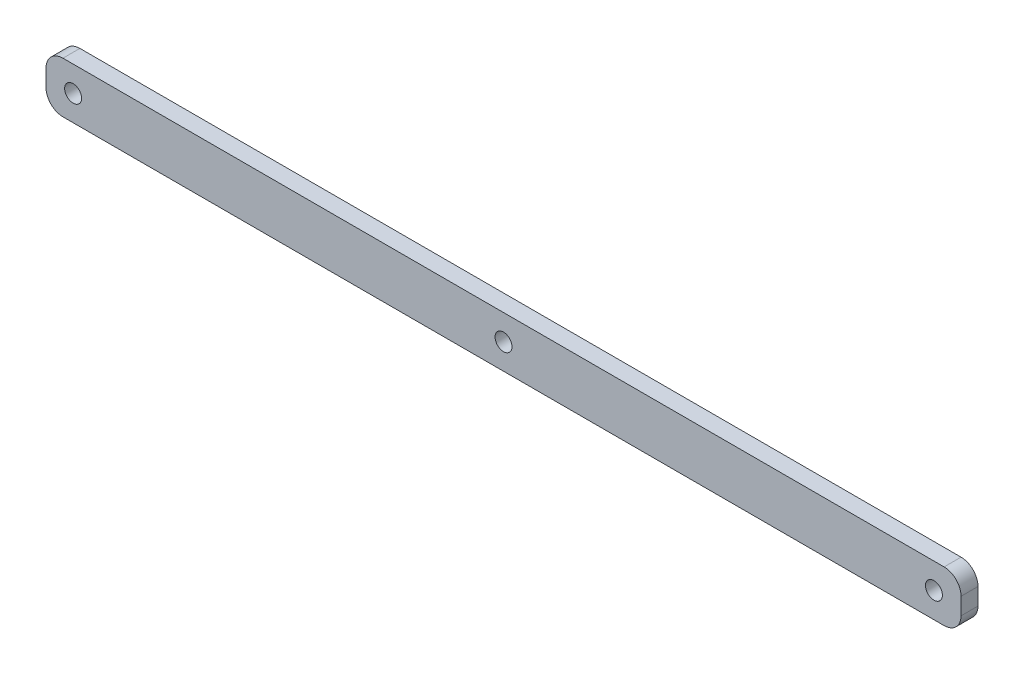
from build123d import *

# Parameters (mm, degrees)
BOSS_EXTRUDE1_DEPTH = 10
SKETCH3_R           = 5
CUT_EXTRUDE1_DEPTH  = 272.845544381
SKETCH4_R           = 5
CUT_EXTRUDE2_DEPTH  = 272.845544381


with BuildPart() as part:
    # Sketch2 → Boss-Extrude1 (new body)
    with BuildSketch(Plane.XY):
        with BuildLine():
            Line((-260, 0), (260, 0))
            ThreePointArc((260, 0), (267.071067812, 2.928932188), (270, 10))
            Line((270, 10), (270, 20))
            ThreePointArc((270, 20), (267.071067812, 27.071067812), (260, 30))
            Line((260, 30), (-260, 30))
            ThreePointArc((-260, 30), (-267.071067812, 27.071067812), (-270, 20))
            Line((-270, 20), (-270, 10))
            ThreePointArc((-270, 10), (-267.071067812, 2.928932188), (-260, 0))
        make_face()
    extrude(amount=BOSS_EXTRUDE1_DEPTH)

    # Sketch3 → Cut-Extrude1 (cut, through all)
    with BuildSketch(Plane(origin=(0, 0, 0), x_dir=(-1, 0, 0), z_dir=(0, 0, -1))):
        with Locations((254, 15)):
            Circle(SKETCH3_R)
        with Locations((-254, 15)):
            Circle(SKETCH3_R)
    extrude(amount=-CUT_EXTRUDE1_DEPTH, mode=Mode.SUBTRACT)

    # Sketch4 → Cut-Extrude2 (cut, through all)
    with BuildSketch(Plane(origin=(0, 0, 0), x_dir=(-1, 0, 0), z_dir=(0, 0, -1))):
        with Locations((0, 15)):
            Circle(SKETCH4_R)
    extrude(amount=-CUT_EXTRUDE2_DEPTH, mode=Mode.SUBTRACT)


solid = part.part
